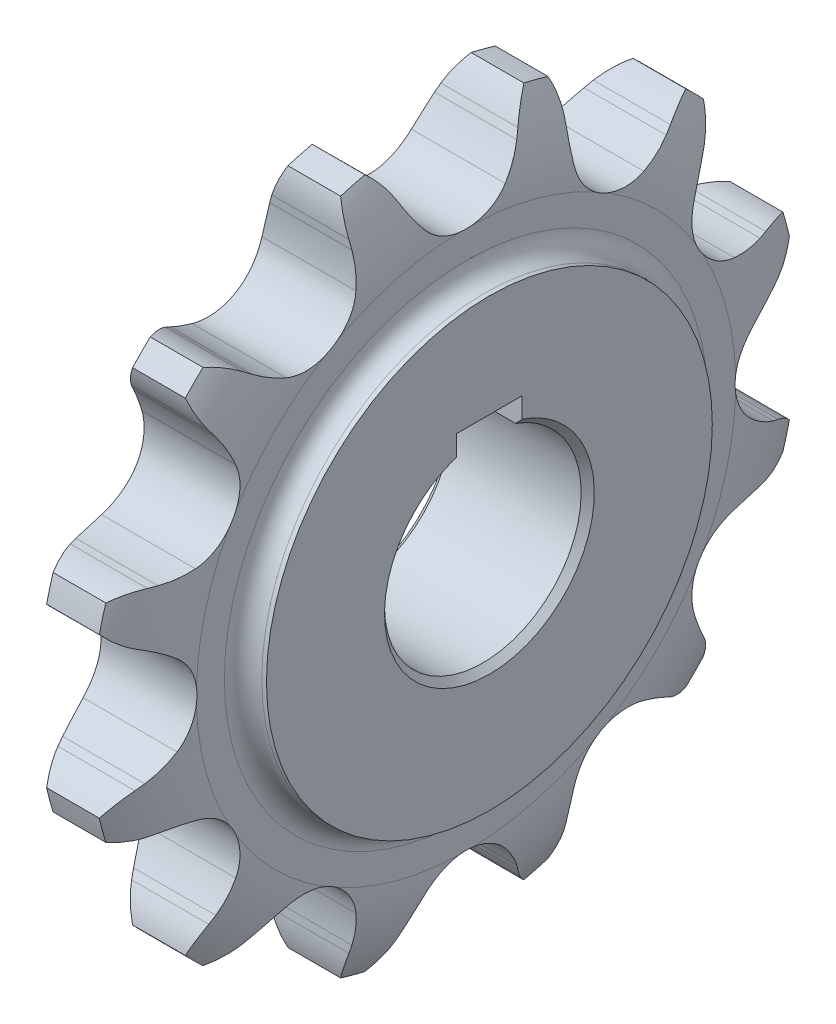
from build123d import *

# Parameters (mm, degrees)
CUT_EXTRUDE_1_DEPTH      = 10.888265988
PATTERN_CIRCULAR_1_COUNT = 12
SKETCH_3_W               = 1.776531976
SKETCH_3_H               = 13.814713973
SKETCH_4_W               = 10
SKETCH_4_H               = 4.157864376
CUT_EXTRUDE_2_DEPTH      = 78.539960969
CHAMFER_1_SIZE           = 1
CHAMFER_3_SIZE           = 1


with BuildPart() as part:
    # 草图1 → 旋转1 (revolve)
    with BuildSketch(Plane.XY, mode=Mode.PRIVATE) as revolve_1_sk:
        with BuildLine():
            Line((-10.888265988, 15), (-10.888265988, 34))
            Line((-10.888265988, 34), (-10.17536279, 34))
            ThreePointArc((-10.17536279, 34), (-8.158968049, 34.835218049), (-7.32375, 36.85161279))
            Line((-7.32375, 36.85161279), (-7.32375, 41.129031975))
            ThreePointArc((-7.32375, 41.129031975), (-6.529327244, 47.784267762), (-4.02175, 54))
            Line((-4.02175, 54), (4.02175, 54))
            ThreePointArc((4.02175, 54), (6.529327244, 47.784267762), (7.32375, 41.129031975))
            Line((7.32375, 41.129031975), (7.32375, 36.85161279))
            ThreePointArc((7.32375, 36.85161279), (8.158968049, 34.835218049), (10.17536279, 34))
            Line((10.17536279, 34), (10.888265988, 34))
            Line((10.888265988, 34), (10.888265988, 15))
            Line((10.888265988, 15), (-10.888265988, 15))
        make_face()
    revolve(revolve_1_sk.sketch.rotate(Axis((-12.7, 0, 0), (1, 0, 0)), 90), axis=Axis((-12.7, 0, 0), (1, 0, 0)))

    # 草图2 → 切除-拉伸1 (cut, symmetric)
    with BuildSketch(Plane(origin=(0, 0, 0), x_dir=(0, 0, -1), z_dir=(1, 0, 0))):
        with BuildLine():
            Line((8.796482469, 47.929738206), (9.35516364, 49.042163878))
            ThreePointArc((9.35516364, 49.042163878), (10.564926683, 50.965449982), (12.119649724, 52.622372529))
            ThreePointArc((12.119649724, 52.622372529), (0, 54), (-12.119649724, 52.622372529))
            ThreePointArc((-12.119649724, 52.622372529), (-10.564926683, 50.965449982), (-9.35516364, 49.042163878))
            Line((-9.35516364, 49.042163878), (-8.796482469, 47.929738206))
            ThreePointArc((-8.796482469, 47.929738206), (-7.59092503, 45.84165147), (-6.151107065, 43.907640306))
            ThreePointArc((-6.151107065, 43.907640306), (0, 41.039331975), (6.151107065, 43.907640306))
            ThreePointArc((6.151107065, 43.907640306), (7.59092503, 45.84165147), (8.796482469, 47.929738206))
        make_face()
    cut_extrude_1 = extrude(amount=CUT_EXTRUDE_1_DEPTH, both=True, mode=Mode.SUBTRACT)

    # 阵列(圆周)1: 切除-拉伸1 ×12 about axis
    pattern_circular_1_axis = Axis((0, 0, 0), (1, 0, 0))
    for i in range(1, PATTERN_CIRCULAR_1_COUNT):
        add(cut_extrude_1.rotate(pattern_circular_1_axis, i * 360 / PATTERN_CIRCULAR_1_COUNT), mode=Mode.SUBTRACT)

    # 草图3 → 旋转2 (revolve)
    with BuildSketch(Plane.XY):
        with Locations((10, 21.907356987)):
            Rectangle(SKETCH_3_W, SKETCH_3_H)
    revolve(axis=Axis((0, 0, 0), (1, 0, 0)))

    # 草图4 → 切除-拉伸2 (cut, through all)
    with BuildSketch(Plane.ZY.offset(10.888265988)):
        with Locations((0, 16.221067812)):
            Rectangle(SKETCH_4_W, SKETCH_4_H)
    extrude(amount=-CUT_EXTRUDE_2_DEPTH, mode=Mode.SUBTRACT)

    # 倒角1
    chamfer_1_edges = [part.edges().sort_by_distance(p)[0] for p in [
        (-10.888265988, -15, 0),
    ]]
    chamfer(chamfer_1_edges, length=CHAMFER_1_SIZE)

    # 倒角3
    chamfer_3_edges = [part.edges().sort_by_distance(p)[0] for p in [
        (10.888265988, -15, 0),
    ]]
    chamfer(chamfer_3_edges, length=CHAMFER_3_SIZE)


solid = part.part
